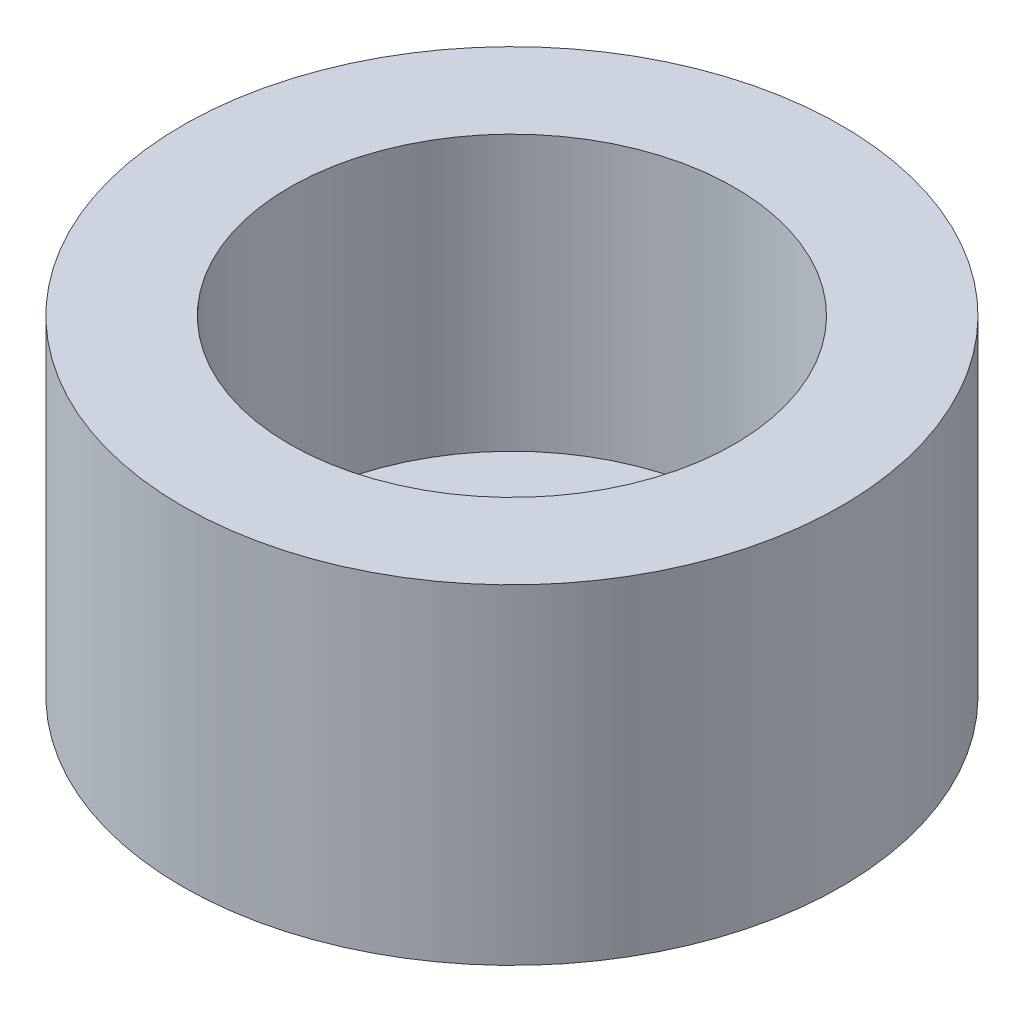
from build123d import *

# Parameters (mm, degrees)
SKIZZE1_R                       = 6
SKIZZE1_R_2                     = 1.75
AUFSATZ_LINEAR_AUSTRAGEN1_DEPTH = 1
SKIZZE4_R                       = 6
SKIZZE4_R_2                     = 4.05
AUFSATZ_LINEAR_AUSTRAGEN2_DEPTH = 5


with BuildPart() as part:
    # Skizze1 → Aufsatz-Linear austragen1 (new body)
    with BuildSketch(Plane(origin=(0, 0, 0), x_dir=(1, 0, 0), z_dir=(0, 1, 0))):
        with Locations(Location((0, 0, 0), (0, 0, 270))):
            Circle(SKIZZE1_R)
        with Locations(Location((0, 0, 0), (0, 0, 270))):
            Circle(SKIZZE1_R_2, mode=Mode.SUBTRACT)
    extrude(amount=AUFSATZ_LINEAR_AUSTRAGEN1_DEPTH)

    # Skizze4 → Aufsatz-Linear austragen2 (add)
    with BuildSketch(Plane(origin=(0, 1, 0), x_dir=(1, 0, 0), z_dir=(0, 1, 0))):
        with Locations(Location((0, 0, 0), (0, 0, 270))):
            Circle(SKIZZE4_R)
        with Locations(Location((0, 0, 0), (0, 0, 270))):
            Circle(SKIZZE4_R_2, mode=Mode.SUBTRACT)
    extrude(amount=AUFSATZ_LINEAR_AUSTRAGEN2_DEPTH)


solid = part.part
